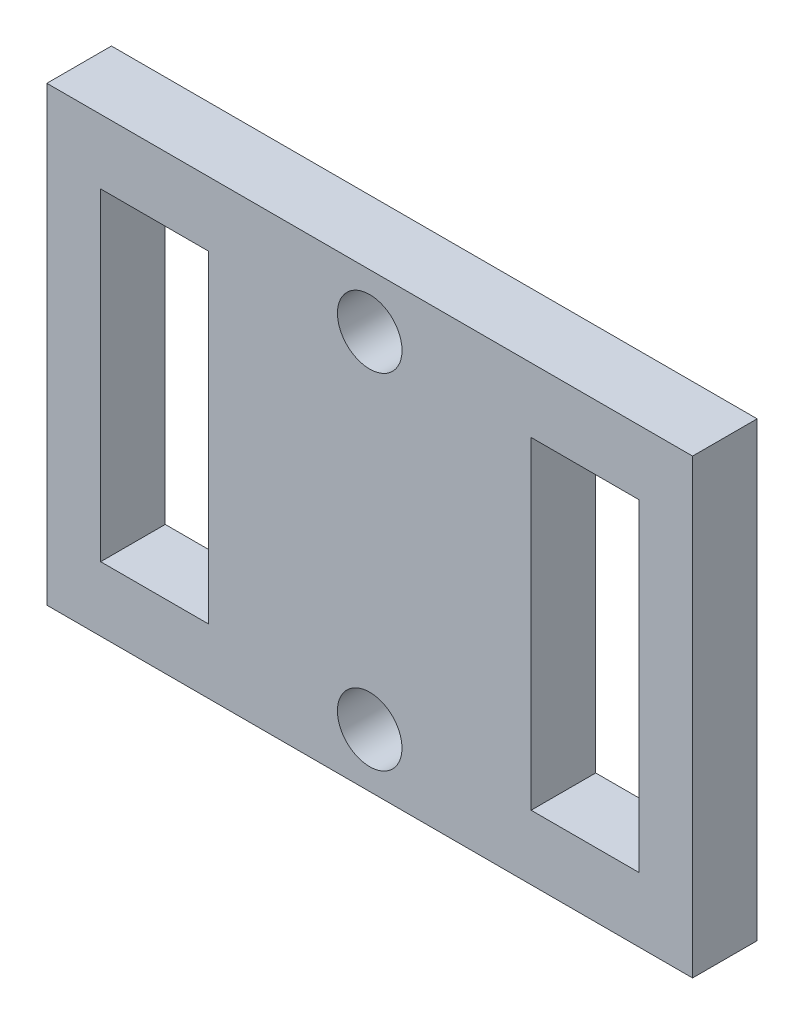
from build123d import *

# Parameters (mm, degrees)
SKETCH_1_W          = 30
SKETCH_1_H          = 21
SKETCH_1_R          = 1.5
EXTRUDE_1_DEPTH     = 3
SKETCH_2_W          = 5
SKETCH_2_H          = 15
CUT_EXTRUDE_1_DEPTH = 19.553975315


with BuildPart() as part:
    # 草图1 → 凸台-拉伸1 (new body)
    with BuildSketch(Plane.XY):
        Rectangle(SKETCH_1_W, SKETCH_1_H)
        with Locations((0, 8)):
            Circle(SKETCH_1_R, mode=Mode.SUBTRACT)
        with Locations(Location((0, -8, 0), (0, 0, 180))):
            Circle(SKETCH_1_R, mode=Mode.SUBTRACT)
    extrude(amount=EXTRUDE_1_DEPTH)

    # 草图2 → 切除-拉伸1 (cut, through all)
    with BuildSketch(Plane.XY.offset(3)):
        with Locations((-10, 0)):
            Rectangle(SKETCH_2_W, SKETCH_2_H)
        with Locations((10, 0)):
            Rectangle(SKETCH_2_W, SKETCH_2_H)
    extrude(amount=-CUT_EXTRUDE_1_DEPTH, mode=Mode.SUBTRACT)


solid = part.part
